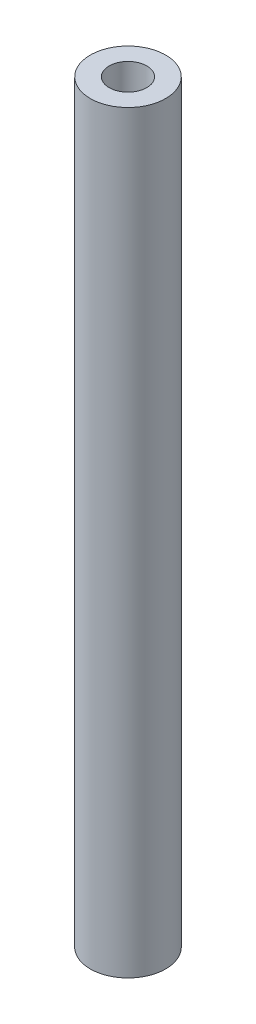
from build123d import *

# Parameters (mm, degrees)
SKETCH1_R           = 4
SKETCH1_R_2         = 2
BOSS_EXTRUDE1_DEPTH = 80


with BuildPart() as part:
    # Sketch1 → Boss-Extrude1 (new body)
    with BuildSketch(Plane(origin=(0, 0, 0), x_dir=(1, 0, 0), z_dir=(0, 1, 0))):
        with Locations(Location((0, 0, 0), (0, 0, 270))):
            Circle(SKETCH1_R)
        with Locations(Location((0, 0, 0), (0, 0, 270))):
            Circle(SKETCH1_R_2, mode=Mode.SUBTRACT)
    extrude(amount=BOSS_EXTRUDE1_DEPTH)


solid = part.part
